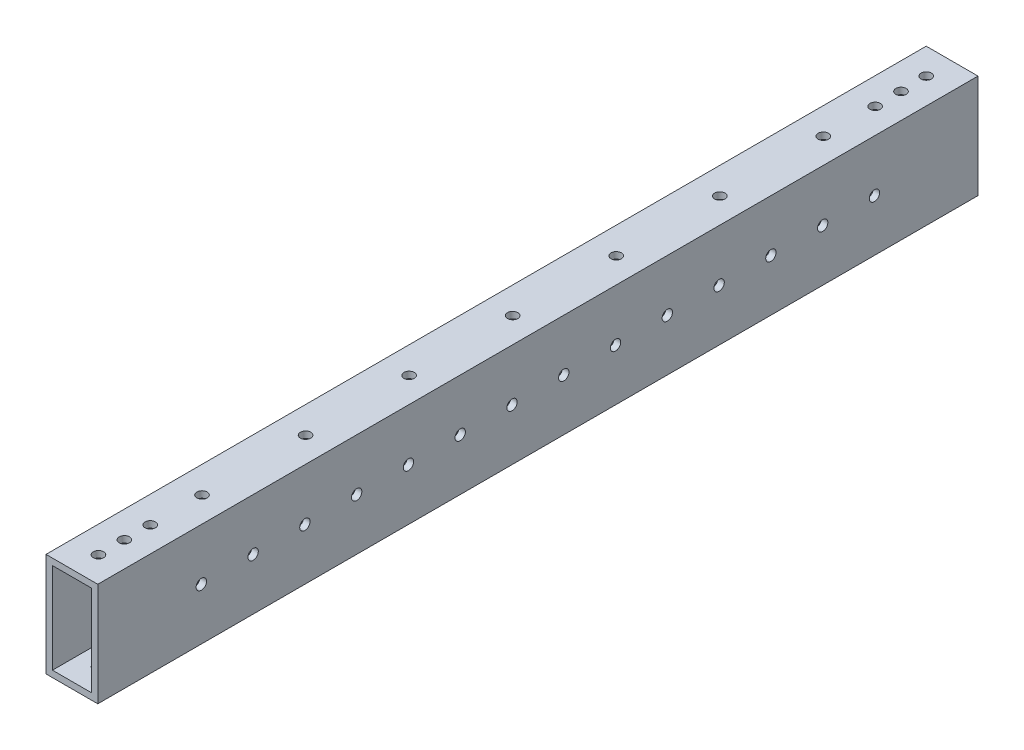
from build123d import *

# Parameters (mm, degrees)
SKETCH1_W           = 25.4
SKETCH1_H           = 50.8
SKETCH1_W_2         = 19.05
SKETCH1_H_2         = 44.45
BOSS_EXTRUDE1_DEPTH = 431.8
SKETCH2_R           = 2.54
CUT_EXTRUDE1_DEPTH  = 436.519276267
SKETCH3_R           = 2.54
CUT_EXTRUDE2_DEPTH  = 436.519276267


with BuildPart() as part:
    # Sketch1 → Boss-Extrude1 (new body)
    with BuildSketch(Plane.XY):
        with Locations((12.7, 25.4)):
            Rectangle(SKETCH1_W, SKETCH1_H)
        with Locations((12.7, 25.4)):
            Rectangle(SKETCH1_W_2, SKETCH1_H_2, mode=Mode.SUBTRACT)
    extrude(amount=BOSS_EXTRUDE1_DEPTH)

    # Sketch2 → Cut-Extrude1 (cut, through all)
    with BuildSketch(Plane(origin=(0, 50.8, 0), x_dir=(1, 0, 0), z_dir=(0, 1, 0))):
        with Locations(Location((12.7, -12.7, 0), (0, 0, 270))):
            Circle(SKETCH2_R)
        with Locations(Location((13.029725146, -25.4, 0), (0, 0, 270))):
            Circle(SKETCH2_R)
        with Locations(Location((13.029725146, -38.1, 0), (0, 0, 270))):
            Circle(SKETCH2_R)
        with Locations(Location((13.029725146, -406.4, 0), (0, 0, 270))):
            Circle(SKETCH2_R)
        with Locations(Location((13.029725146, -419.1, 0), (0, 0, 270))):
            Circle(SKETCH2_R)
        with Locations(Location((13.029725146, -393.7, 0), (0, 0, 270))):
            Circle(SKETCH2_R)
        with Locations(Location((13.029725146, -368.3, 0), (0, 0, 270))):
            Circle(SKETCH2_R)
        with Locations(Location((13.029725146, -317.5, 0), (0, 0, 270))):
            Circle(SKETCH2_R)
        with Locations(Location((13.029725146, -266.7, 0), (0, 0, 270))):
            Circle(SKETCH2_R)
        with Locations(Location((13.029725146, -215.9, 0), (0, 0, 270))):
            Circle(SKETCH2_R)
        with Locations(Location((13.029725146, -165.1, 0), (0, 0, 270))):
            Circle(SKETCH2_R)
        with Locations(Location((13.029725146, -114.3, 0), (0, 0, 270))):
            Circle(SKETCH2_R)
        with Locations(Location((13.029725146, -63.5, 0), (0, 0, 270))):
            Circle(SKETCH2_R)
    extrude(amount=-CUT_EXTRUDE1_DEPTH, mode=Mode.SUBTRACT)

    # Sketch3 → Cut-Extrude2 (cut, through all)
    with BuildSketch(Plane(origin=(25.4, 0, 0), x_dir=(0, 0, -1), z_dir=(1, 0, 0))):
        with Locations((-381, 25.4)):
            Circle(SKETCH3_R)
        with Locations((-355.6, 25.4)):
            Circle(SKETCH3_R)
        with Locations((-330.2, 25.4)):
            Circle(SKETCH3_R)
        with Locations((-304.8, 25.4)):
            Circle(SKETCH3_R)
        with Locations((-279.4, 25.4)):
            Circle(SKETCH3_R)
        with Locations((-254, 25.4)):
            Circle(SKETCH3_R)
        with Locations((-228.6, 25.4)):
            Circle(SKETCH3_R)
        with Locations((-203.2, 25.4)):
            Circle(SKETCH3_R)
        with Locations((-177.8, 25.4)):
            Circle(SKETCH3_R)
        with Locations((-152.4, 25.4)):
            Circle(SKETCH3_R)
        with Locations((-127, 25.4)):
            Circle(SKETCH3_R)
        with Locations((-101.6, 25.4)):
            Circle(SKETCH3_R)
        with Locations((-76.2, 25.4)):
            Circle(SKETCH3_R)
        with Locations((-50.8, 25.4)):
            Circle(SKETCH3_R)
    extrude(amount=-CUT_EXTRUDE2_DEPTH, mode=Mode.SUBTRACT)


solid = part.part
